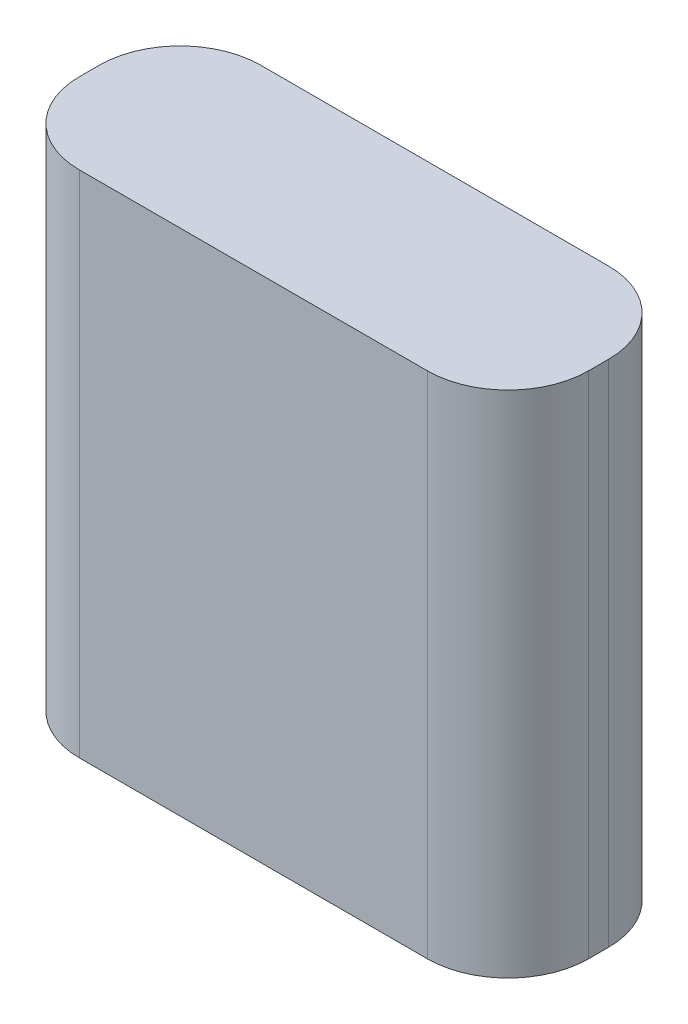
from build123d import *

# Parameters (mm, degrees)
SKETCH1_W           = 80.264
SKETCH1_H           = 28.575
BOSS_EXTRUDE1_DEPTH = 80.264
FILLET1_R           = 12.7


with BuildPart() as part:
    # Sketch1 → Boss-Extrude1 (new body)
    with BuildSketch(Plane(origin=(0, 0, 0), x_dir=(1, 0, 0), z_dir=(0, 1, 0))):
        Rectangle(SKETCH1_W, SKETCH1_H)
    extrude(amount=BOSS_EXTRUDE1_DEPTH)

    # Fillet1
    fillet1_edges = [part.edges().sort_by_distance(p)[0] for p in [
        (40.132, 40.132, 14.2875),
        (-40.132, 40.132, 14.2875),
        (-40.132, 40.132, -14.2875),
        (40.132, 40.132, -14.2875),
    ]]
    fillet(fillet1_edges, radius=FILLET1_R)


solid = part.part
